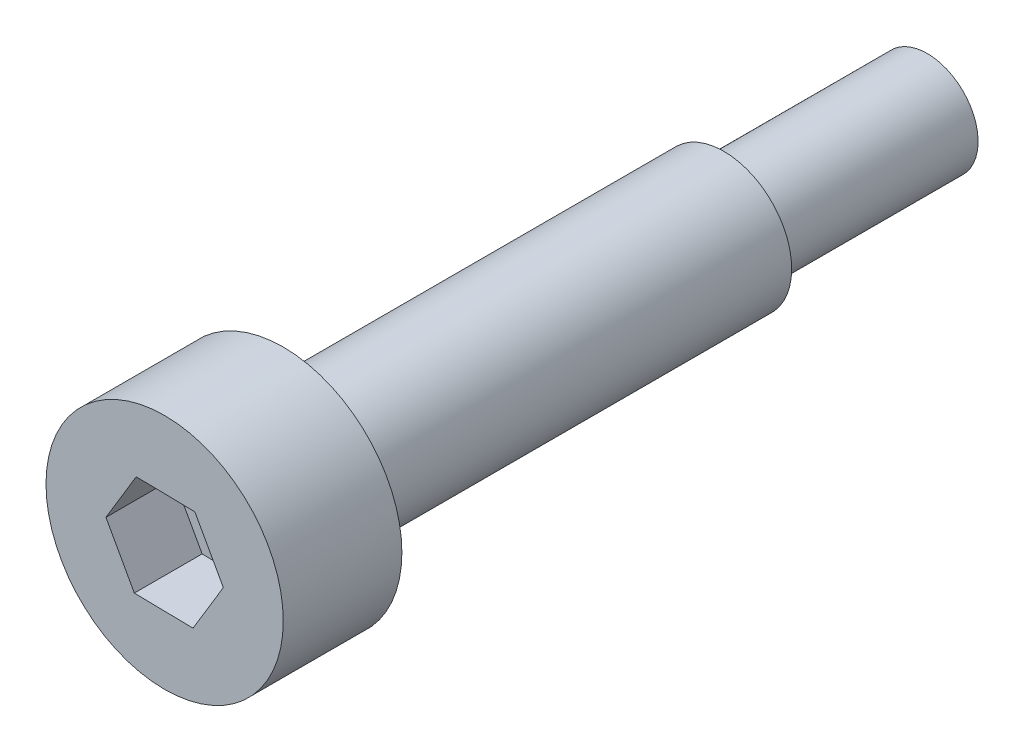
from build123d import *

# Parameters (mm, degrees)
SKETCH_1_R          = 3.5
EXTRUDE_1_DEPTH     = 3.5
CUT_EXTRUDE_1_DEPTH = 2
SKETCH_3_R          = 2
EXTRUDE_2_DEPTH     = 13
SKETCH_4_R          = 1.5
EXTRUDE_3_DEPTH     = 6


with BuildPart() as part:
    # 草图1 → 凸台-拉伸1 (new body)
    with BuildSketch(Plane.XY):
        Circle(SKETCH_1_R)
    extrude(amount=EXTRUDE_1_DEPTH)

    # 草图2 → 切除-拉伸1 (cut)
    with BuildSketch(Plane.XY.offset(3.5)):
        Polygon((0.893639487, 1.483714416), (-0.838114632, 1.515771705), (-1.731754119, 0.03205729), (-0.893639487, -1.483714416), (0.838114632, -1.515771705), (1.731754119, -0.03205729), align=None)
    extrude(amount=-CUT_EXTRUDE_1_DEPTH, mode=Mode.SUBTRACT)

    # 草图3 → 凸台-拉伸2 (add)
    with BuildSketch(Plane(origin=(0, 0, 0), x_dir=(-1, 0, 0), z_dir=(0, 0, -1))):
        with Locations(Location((0, 0, 0), (0, 0, 180))):
            Circle(SKETCH_3_R)
    extrude(amount=EXTRUDE_2_DEPTH)

    # 草图4 → 凸台-拉伸3 (add)
    with BuildSketch(Plane(origin=(0, 0, -13), x_dir=(-1, 0, 0), z_dir=(0, 0, -1))):
        Circle(SKETCH_4_R)
    extrude(amount=EXTRUDE_3_DEPTH)


solid = part.part
